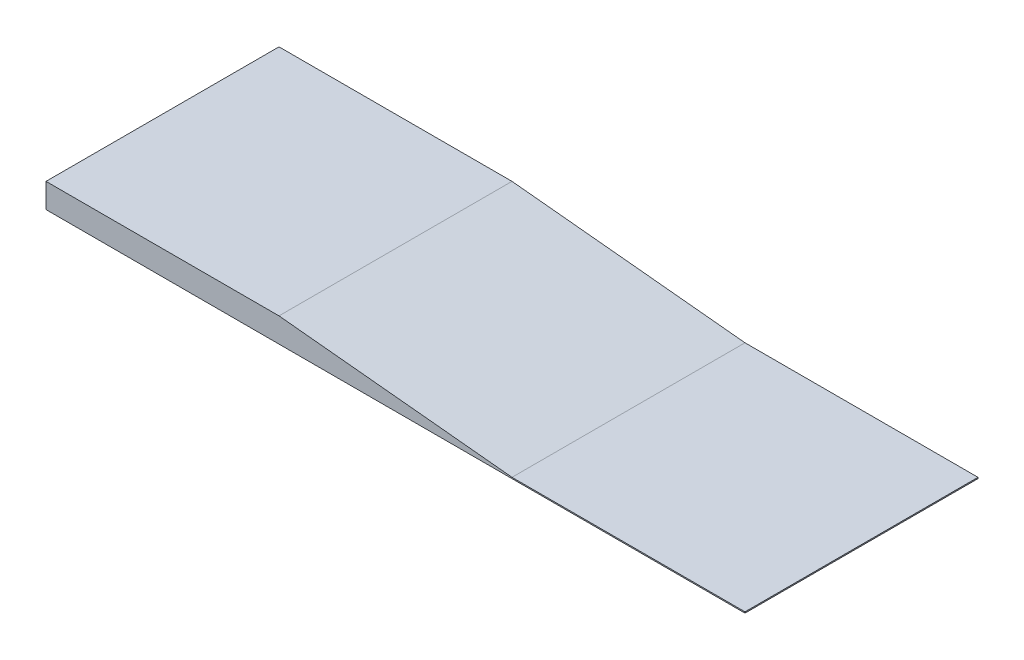
from build123d import *

# Parameters (mm, degrees)
EXTRUDE_1_DEPTH = 2000


with BuildPart() as part:
    # 草图1 → 凸台-拉伸1 (new body)
    with BuildSketch(Plane.XY):
        Polygon((0, 0), (2000, -200), (4000, -200), (4000, -210), (0, -210), (-2000, -210), (-2000, 0), align=None)
    extrude(amount=EXTRUDE_1_DEPTH)


solid = part.part
